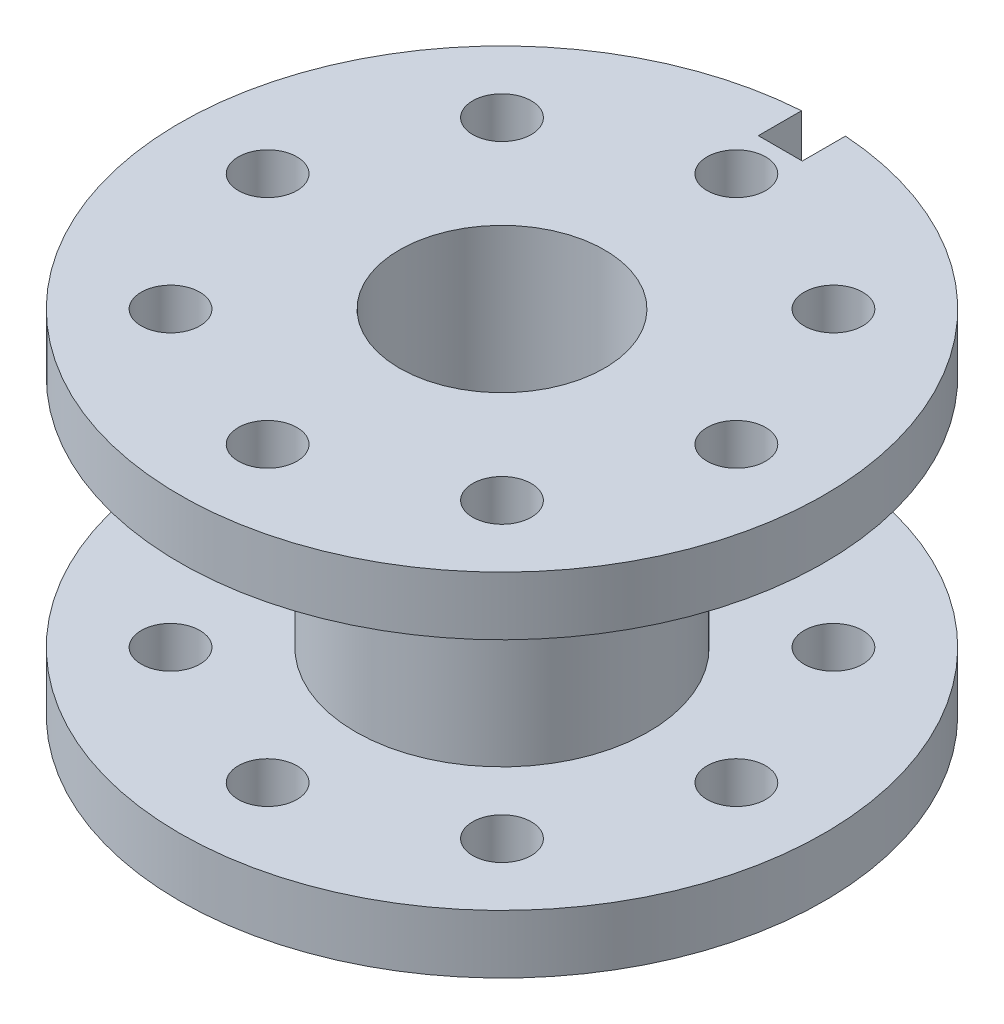
from build123d import *

# Parameters (mm, degrees)
SKETCH1_R           = 11
SKETCH1_R_2         = 1
BOSS_EXTRUDE1_DEPTH = 12
SKETCH2_R           = 3.5
CUT_EXTRUDE1_DEPTH  = 20.646882704
CUT_EXTRUDE2_START  = -8
SKETCH3_R           = 11
SKETCH3_R_2         = 5
CUT_EXTRUDE2_DEPTH  = 8
SKETCH4_W           = 1.5
SKETCH4_H           = 3
CUT_EXTRUDE3_DEPTH  = 4


with BuildPart() as part:
    # Sketch1 → Boss-Extrude1 (new body)
    with BuildSketch(Plane(origin=(0, 0, 0), x_dir=(1, 0, 0), z_dir=(0, 1, 0))):
        with Locations(Location((0, 0, 0), (0, 0, 270))):
            Circle(SKETCH1_R)
        with Locations(Location((0, 8, 0), (0, 0, 270))):
            Circle(SKETCH1_R_2, mode=Mode.SUBTRACT)
        with Locations(Location((5.656854249, 5.656854249, 0), (0, 0, 270))):
            Circle(SKETCH1_R_2, mode=Mode.SUBTRACT)
        with Locations(Location((8, 0, 0), (0, 0, 270))):
            Circle(SKETCH1_R_2, mode=Mode.SUBTRACT)
        with Locations(Location((5.656854249, -5.656854249, 0), (0, 0, 270))):
            Circle(SKETCH1_R_2, mode=Mode.SUBTRACT)
        with Locations(Location((0, -8, 0), (0, 0, 270))):
            Circle(SKETCH1_R_2, mode=Mode.SUBTRACT)
        with Locations(Location((-5.656854249, -5.656854249, 0), (0, 0, 270))):
            Circle(SKETCH1_R_2, mode=Mode.SUBTRACT)
        with Locations(Location((-8, 0, 0), (0, 0, 270))):
            Circle(SKETCH1_R_2, mode=Mode.SUBTRACT)
        with Locations(Location((-5.656854249, 5.656854249, 0), (0, 0, 270))):
            Circle(SKETCH1_R_2, mode=Mode.SUBTRACT)
    extrude(amount=BOSS_EXTRUDE1_DEPTH)

    # Sketch2 → Cut-Extrude1 (cut, through all)
    with BuildSketch(Plane(origin=(0, 12, 0), x_dir=(1, 0, 0), z_dir=(0, 1, 0))):
        with Locations(Location((0, 0, 0), (0, 0, 270))):
            Circle(SKETCH2_R)
    extrude(amount=-CUT_EXTRUDE1_DEPTH, mode=Mode.SUBTRACT)

    # Sketch3 → Cut-Extrude2 (cut)
    with BuildSketch(Plane(origin=(0, 10, 0), x_dir=(1, 0, 0), z_dir=(0, 1, 0)).offset(CUT_EXTRUDE2_START)):
        with Locations(Location((0, 0, 0), (0, 0, 270))):
            Circle(SKETCH3_R)
        with Locations(Location((0, 0, 0), (0, 0, 270))):
            Circle(SKETCH3_R_2, mode=Mode.SUBTRACT)
    extrude(amount=CUT_EXTRUDE2_DEPTH, mode=Mode.SUBTRACT)

    # Sketch4 → Cut-Extrude3 (cut)
    with BuildSketch(Plane(origin=(0, 12, 0), x_dir=(1, 0, 0), z_dir=(0, 1, 0))):
        with Locations((0, 11)):
            Rectangle(SKETCH4_W, SKETCH4_H)
    extrude(amount=-CUT_EXTRUDE3_DEPTH, mode=Mode.SUBTRACT)


solid = part.part
